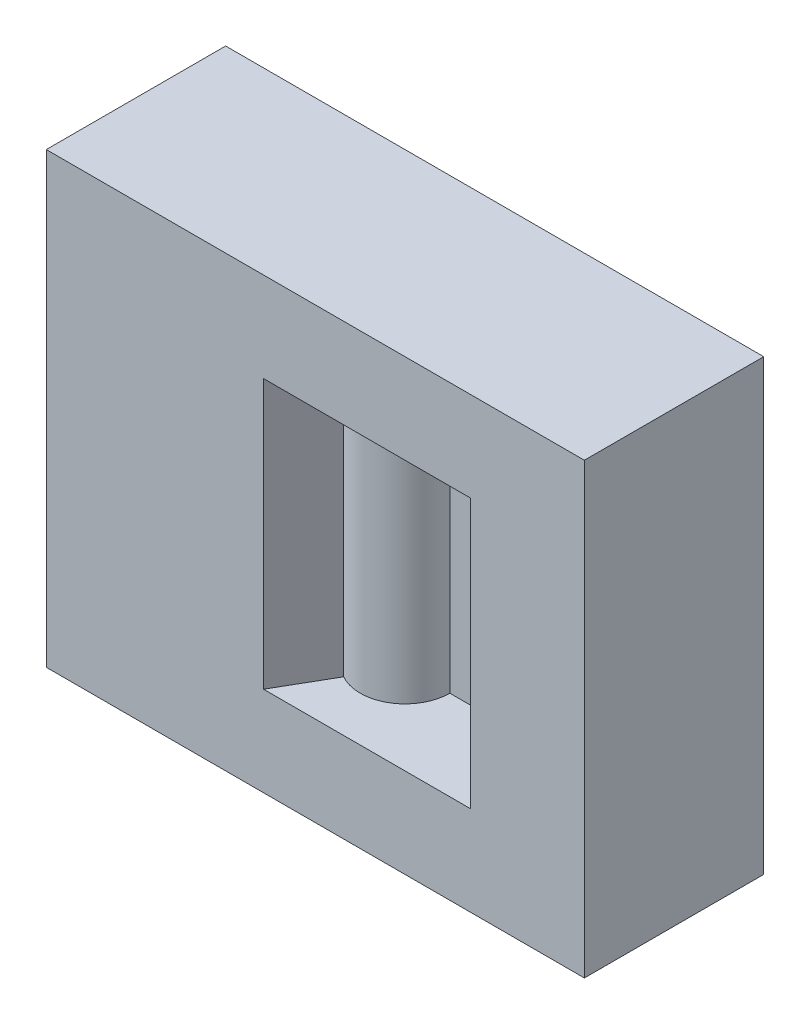
from build123d import *

# Parameters (mm, degrees)
SKETCH1_W           = 60
SKETCH1_H           = 50
BOSS_EXTRUDE1_DEPTH = 10
SKETCH2_W           = 15
SKETCH2_H           = 30
CUT_REVOLVE1_ANGLE  = 120


with BuildPart() as part:
    # Sketch1 → Boss-Extrude1 (new, symmetric)
    with BuildSketch(Plane.XY):
        with Locations((0, 15)):
            Rectangle(SKETCH1_W, SKETCH1_H)
    extrude(amount=BOSS_EXTRUDE1_DEPTH, both=True)

    # Sketch2 → Cut-Revolve1 (revolve, cut)
    with BuildSketch(Plane.XY):
        with Locations((12.5, 15)):
            Rectangle(SKETCH2_W, SKETCH2_H)
    revolve(axis=Axis((0, 0, 0), (0, -1, 0)), revolution_arc=CUT_REVOLVE1_ANGLE, mode=Mode.SUBTRACT)


solid = part.part
